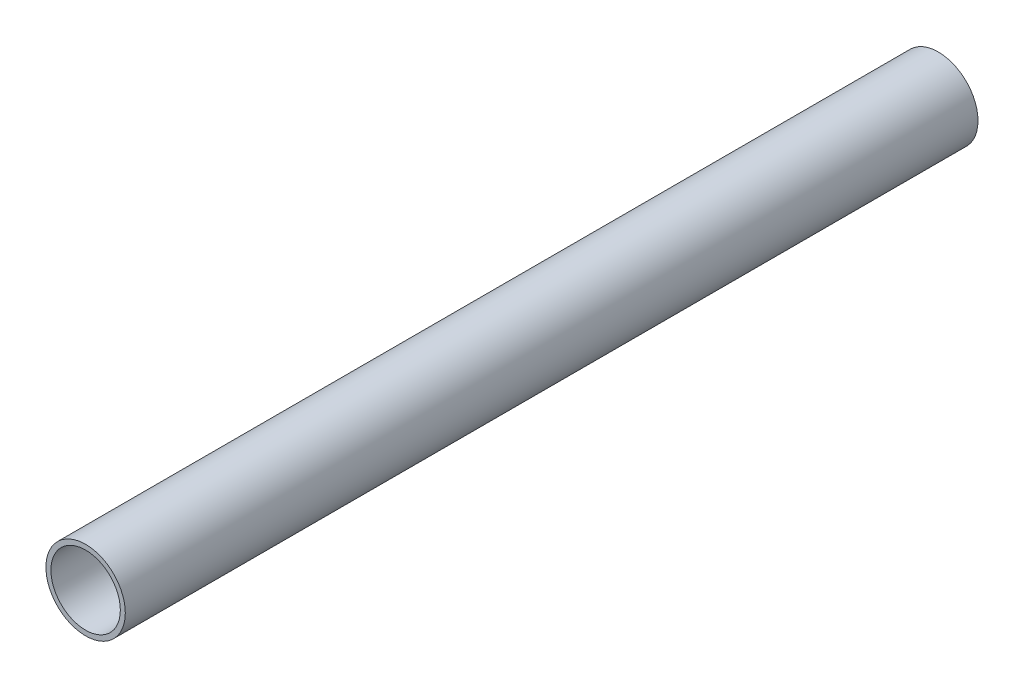
from build123d import *

# Parameters (mm, degrees)
SKETCH1_R           = 12.7
SKETCH1_R_2         = 11.1125
BOSS_EXTRUDE1_DEPTH = 272.89


with BuildPart() as part:
    # Sketch1 → Boss-Extrude1 (new body)
    with BuildSketch(Plane.XY):
        Circle(SKETCH1_R)
        Circle(SKETCH1_R_2, mode=Mode.SUBTRACT)
    extrude(amount=BOSS_EXTRUDE1_DEPTH)


solid = part.part
